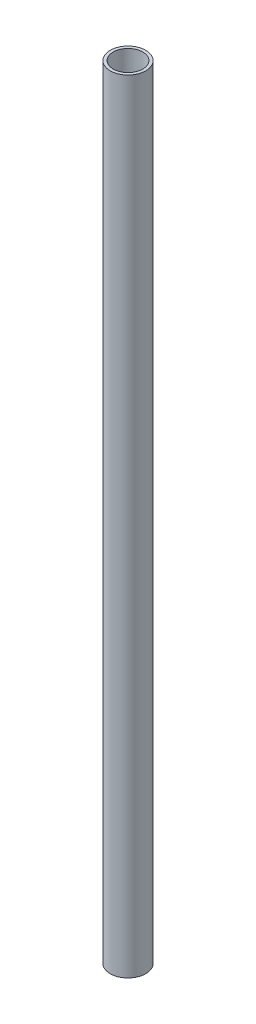
from build123d import *

# Parameters (mm, degrees)
SKETCH1_R           = 21.082
SKETCH1_R_2         = 17.526
BOSS_EXTRUDE1_DEPTH = 927.1


with BuildPart() as part:
    # Sketch1 → Boss-Extrude1 (new body)
    with BuildSketch(Plane(origin=(0, 0, 0), x_dir=(1, 0, 0), z_dir=(0, 1, 0))):
        with Locations(Location((0, 0, 0), (0, 0, 270))):
            Circle(SKETCH1_R)
        with Locations(Location((0, 0, 0), (0, 0, 270))):
            Circle(SKETCH1_R_2, mode=Mode.SUBTRACT)
    extrude(amount=BOSS_EXTRUDE1_DEPTH)


solid = part.part
